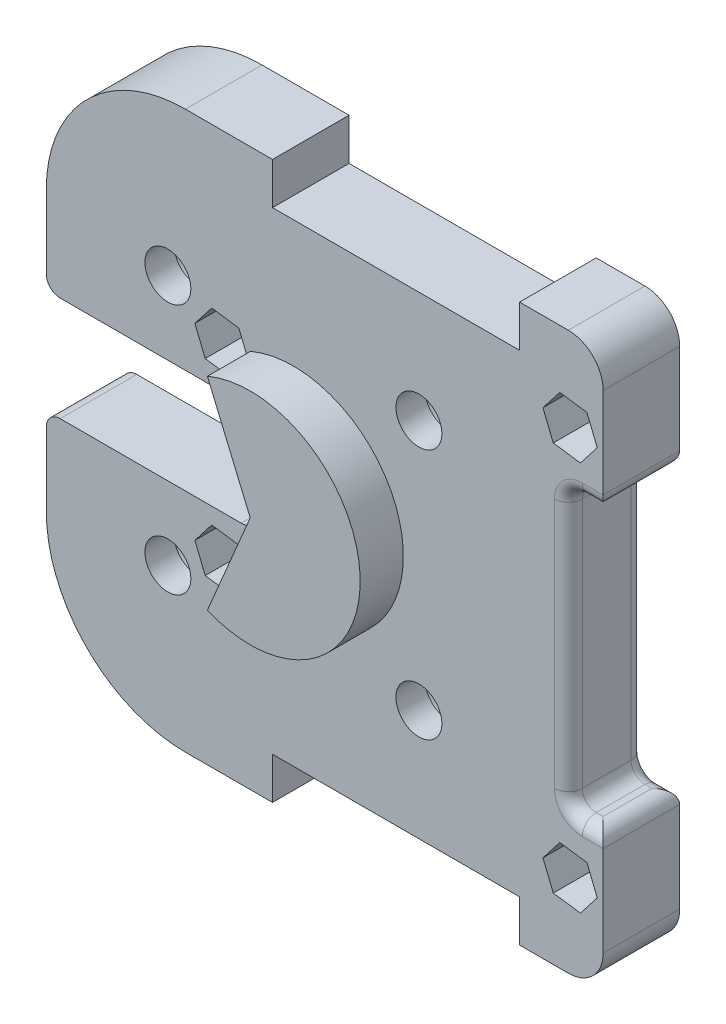
from build123d import *

# Parameters (mm, degrees)
SKETCH_1_W                = 80
SKETCH_1_H                = 80
EXTRUDE_1_DEPTH           = 11
FILLET_1_R                = 20
FILLET_2_R                = 5
SKETCH_2_W                = 30
SKETCH_2_H                = 15
CUT_EXTRUDE_1_DEPTH       = 11
FILLET_3_R                = 2
SKETCH_3_W                = 35.5
SKETCH_3_H                = 6
CUT_EXTRUDE_2_DEPTH       = 11
SKETCH_4_W                = 35.5
SKETCH_4_H                = 6
CUT_EXTRUDE_3_DEPTH       = 11
SKETCH_5_W                = 5
SKETCH_5_H                = 40
CUT_EXTRUDE_4_DEPTH       = 11
FILLET_4_R                = 2
SKETCH_8_R                = 1.9
CUT_EXTRUDE_5_DEPTH       = 11
CUT_EXTRUDE_6_DEPTH       = 8.5
EXTRUDE_2_DEPTH           = 6.2
HOLE_WIZARD_2_D           = 6.6
HOLE_WIZARD_2_CBORE_D     = 11
HOLE_WIZARD_2_CBORE_DEPTH = 6.8


with BuildPart() as part:
    # 草图1 → 凸台-拉伸1 (new body)
    with BuildSketch(Plane.XY):
        with Locations((3.759980536, -13.590563907)):
            Rectangle(SKETCH_1_W, SKETCH_1_H)
    extrude(amount=EXTRUDE_1_DEPTH)

    # 圆角1
    fillet_1_edges = [part.edges().sort_by_distance(p)[0] for p in [
        (-36.240019464, 26.409436093, 5.5),
        (-36.240019464, -53.590563907, 5.5),
    ]]
    fillet(fillet_1_edges, radius=FILLET_1_R)

    # 圆角2
    fillet_2_edges = [part.edges().sort_by_distance(p)[0] for p in [
        (43.759980536, 26.409436093, 5.5),
        (43.759980536, -53.590563907, 5.5),
    ]]
    fillet(fillet_2_edges, radius=FILLET_2_R)

    # 草图2 → 切除-拉伸1 (cut)
    with BuildSketch(Plane(origin=(0, 0, 0), x_dir=(-1, 0, 0), z_dir=(0, 0, -1))):
        with Locations((21.240019464, -13.590563907)):
            Rectangle(SKETCH_2_W, SKETCH_2_H)
    extrude(amount=-CUT_EXTRUDE_1_DEPTH, mode=Mode.SUBTRACT)

    # 圆角3
    fillet_3_edges = [part.edges().sort_by_distance(p)[0] for p in [
        (-36.240019464, -6.090563907, 5.5),
        (-36.240019464, -21.090563907, 5.5),
        (-6.240019464, -21.090563907, 5.5),
        (-6.240019464, -6.090563907, 5.5),
    ]]
    fillet(fillet_3_edges, radius=FILLET_3_R)

    # 草图3 → 切除-拉伸2 (cut)
    with BuildSketch(Plane.XY.offset(11)):
        with Locations((14.009980536, 23.409436093)):
            Rectangle(SKETCH_3_W, SKETCH_3_H)
    extrude(amount=-CUT_EXTRUDE_2_DEPTH, mode=Mode.SUBTRACT)

    # 草图4 → 切除-拉伸3 (cut)
    with BuildSketch(Plane.XY.offset(11)):
        with Locations((14.009980536, -50.590563907)):
            Rectangle(SKETCH_4_W, SKETCH_4_H)
    extrude(amount=-CUT_EXTRUDE_3_DEPTH, mode=Mode.SUBTRACT)

    # 草图5 → 切除-拉伸4 (cut)
    with BuildSketch(Plane.XY.offset(11)):
        with Locations((41.259980536, -13.590563907)):
            Rectangle(SKETCH_5_W, SKETCH_5_H)
    extrude(amount=-CUT_EXTRUDE_4_DEPTH, mode=Mode.SUBTRACT)

    # 圆角4
    fillet_4_edges = [part.edges().sort_by_distance(p)[0] for p in [
        (43.759980536, 6.409436093, 5.5),
        (41.259980536, -33.590563907, 0),
        (43.759980536, -33.590563907, 5.5),
        (38.759980536, -13.590563907, 0),
        (38.759980536, -33.590563907, 5.5),
        (41.259980536, 6.409436093, 0),
        (38.759980536, 6.409436093, 5.5),
        (41.259980536, 6.409436093, 11),
        (38.759980536, -13.590563907, 11),
        (41.259980536, -33.590563907, 11),
    ]]
    fillet(fillet_4_edges, radius=FILLET_4_R)

    # 草图8 → 切除-拉伸5 (cut)
    with BuildSketch(Plane.XY.offset(11)):
        with Locations((39.009980536, -41.590563907)):
            Circle(SKETCH_8_R)
        with Locations((-10.990019464, -27.090563907)):
            Circle(SKETCH_8_R)
        with Locations((-10.990019464, -0.090563907)):
            Circle(SKETCH_8_R)
        with Locations((39.009980536, 14.409436093)):
            Circle(SKETCH_8_R)
    extrude(amount=-CUT_EXTRUDE_5_DEPTH, mode=Mode.SUBTRACT)

    # 草图9 → 切除-拉伸6 (cut)
    with BuildSketch(Plane.XY.offset(11)):
        Polygon((-14.890383234, -26.550845651), (-13.40761107, -30.198518888), (-9.5072473, -30.738237144), (-7.089655694, -27.630282164), (-8.572427858, -23.982608927), (-12.472791628, -23.442890671), align=None)
        Polygon((37.527208372, -37.942890671), (35.109616766, -41.050845651), (36.59238893, -44.698518888), (40.4927527, -45.238237144), (42.910344306, -42.130282164), (41.427572142, -38.482608927), align=None)
        Polygon((-8.572427858, 3.017391073), (-12.472791628, 3.557109329), (-14.890383234, 0.449154349), (-13.40761107, -3.198518888), (-9.5072473, -3.738237144), (-7.089655694, -0.630282164), align=None)
        Polygon((36.59238893, 11.301481112), (40.4927527, 10.761762856), (42.910344306, 13.869717836), (41.427572142, 17.517391073), (37.527208372, 18.057109329), (35.109616766, 14.949154349), align=None)
    extrude(amount=-CUT_EXTRUDE_6_DEPTH, mode=Mode.SUBTRACT)

    # 草图10 → 凸台-拉伸2 (add)
    with BuildSketch(Plane.XY.offset(11)):
        with BuildLine():
            Line((-0.740019464, -13.590563907), (-6.895850028, 0.960922273))
            ThreePointArc((-6.895850028, 0.960922273), (15.059980536, -13.590563907), (-6.895850028, -28.142050088))
            Line((-6.895850028, -28.142050088), (-0.740019464, -13.590563907))
        make_face()
    extrude(amount=EXTRUDE_2_DEPTH)

    # 打孔尺寸(%根据)内六角圆柱头螺钉的类型2 (through all)
    with Locations(Plane(origin=(0, 0, 0), x_dir=(-1, 0, 0), z_dir=(0, 0, -1))):
        with Locations((-17.291203456, 4.440659013), (18.771242384, 4.440659013), (18.771242384, -31.621786828), (-17.291203456, -31.621786828)):
            CounterBoreHole(HOLE_WIZARD_2_D / 2, HOLE_WIZARD_2_CBORE_D / 2, HOLE_WIZARD_2_CBORE_DEPTH)


solid = part.part
